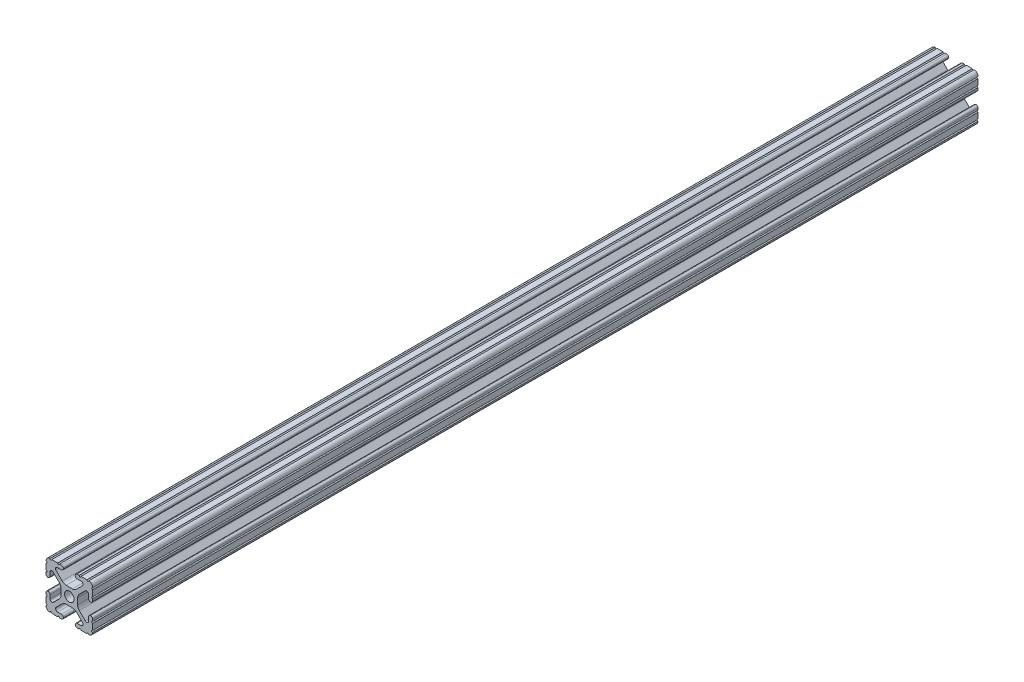
from build123d import *

# Parameters (mm, degrees)
SKETCH1_R           = 2.6035
BOSS_EXTRUDE1_DEPTH = 304.8
SKETCH2_R           = 22.453588809
CUT_EXTRUDE1_DEPTH  = 127


with BuildPart() as part:
    # Sketch1 → Boss-Extrude1 (new, symmetric)
    with BuildSketch(Plane.XY):
        with BuildLine():
            Line((-7.179650497, -8.645192506), (-3.952270251, -5.423690499))
            ThreePointArc((-3.952270251, -5.423690499), (-2.922936451, -4.736929036), (-1.709253557, -4.4958))
            Line((-1.709253557, -4.4958), (1.709253557, -4.4958))
            ThreePointArc((1.709253557, -4.4958), (2.922936451, -4.736929036), (3.952270251, -5.423690499))
            Line((3.952270251, -5.423690499), (7.179650497, -8.645192506))
            ThreePointArc((7.179650497, -8.645192506), (7.41473083, -9.822813117), (6.416408329, -10.4902))
            Line((6.416408329, -10.4902), (4.287512407, -10.4902))
            ThreePointArc((4.287512407, -10.4902), (3.54574862, -10.79744862), (3.2385, -11.539212407))
            Line((3.2385, -11.539212407), (3.2385, -11.650987593))
            ThreePointArc((3.2385, -11.650987593), (3.54574862, -12.39275138), (4.287512407, -12.7))
            Line((4.287512407, -12.7), (5.317126718, -12.7))
            ThreePointArc((5.317126718, -12.7), (5.825126718, -12.192), (6.333126718, -12.7))
            Line((6.333126718, -12.7), (9.550443118, -12.7))
            ThreePointArc((9.550443118, -12.7), (10.058366869, -12.192000006), (10.566443095, -12.699847501))
            ThreePointArc((10.566443095, -12.699847501), (12.082537762, -12.08250727), (12.699846982, -10.566399977))
            ThreePointArc((12.699846982, -10.566399977), (12.192000006, -10.058323491), (12.7, -9.5504))
            Line((12.7, -9.5504), (12.7, -6.3330836))
            ThreePointArc((12.7, -6.3330836), (12.192, -5.8250836), (12.7, -5.3170836))
            Line((12.7, -5.3170836), (12.7, -4.287469289))
            ThreePointArc((12.7, -4.287469289), (12.39275138, -3.545705502), (11.650987593, -3.238456882))
            Line((11.650987593, -3.238456882), (11.539212407, -3.238456882))
            ThreePointArc((11.539212407, -3.238456882), (10.79744862, -3.545705502), (10.4902, -4.287469289))
            Line((10.4902, -4.287469289), (10.4902, -6.402089023))
            ThreePointArc((10.4902, -6.402089023), (9.856505071, -7.351067942), (8.737131347, -7.129408934))
            Line((8.737131347, -7.129408934), (5.441005833, -3.840816462))
            ThreePointArc((5.441005833, -3.840816462), (4.750877967, -2.809883091), (4.5085, -1.593185507))
            Line((4.5085, -1.593185507), (4.5085, 1.593185507))
            ThreePointArc((4.5085, 1.593185507), (4.750877967, 2.809883091), (5.441005833, 3.840816462))
            Line((5.441005833, 3.840816462), (8.737131347, 7.129408934))
            ThreePointArc((8.737131347, 7.129408934), (9.856505071, 7.351067942), (10.4902, 6.402089023))
            Line((10.4902, 6.402089023), (10.4902, 4.287469289))
            ThreePointArc((10.4902, 4.287469289), (10.79744862, 3.545705502), (11.539212407, 3.238456882))
            Line((11.539212407, 3.238456882), (11.650987593, 3.238456882))
            ThreePointArc((11.650987593, 3.238456882), (12.39275138, 3.545705502), (12.7, 4.287469289))
            Line((12.7, 4.287469289), (12.7, 5.3170836))
            ThreePointArc((12.7, 5.3170836), (12.192, 5.8250836), (12.7, 6.3330836))
            Line((12.7, 6.3330836), (12.7, 9.5504))
            ThreePointArc((12.7, 9.5504), (12.192000006, 10.058323491), (12.699846982, 10.566399977))
            ThreePointArc((12.699846982, 10.566399977), (12.082537762, 12.08250727), (10.566443095, 12.699847501))
            ThreePointArc((10.566443095, 12.699847501), (10.058366869, 12.192000006), (9.550443118, 12.7))
            Line((9.550443118, 12.7), (6.333126718, 12.7))
            ThreePointArc((6.333126718, 12.7), (5.825126718, 12.192), (5.317126718, 12.7))
            Line((5.317126718, 12.7), (4.287512407, 12.7))
            ThreePointArc((4.287512407, 12.7), (3.54574862, 12.39275138), (3.2385, 11.650987593))
            Line((3.2385, 11.650987593), (3.2385, 11.539212407))
            ThreePointArc((3.2385, 11.539212407), (3.54574862, 10.79744862), (4.287512407, 10.4902))
            Line((4.287512407, 10.4902), (6.476788598, 10.4902))
            ThreePointArc((6.476788598, 10.4902), (7.432222385, 9.85140422), (7.207036008, 8.724370562))
            Line((7.207036008, 8.724370562), (3.898272566, 5.423169045))
            ThreePointArc((3.898272566, 5.423169045), (2.869120213, 4.736787962), (1.655778399, 4.4958))
            Line((1.655778399, 4.4958), (-1.655778399, 4.4958))
            ThreePointArc((-1.655778399, 4.4958), (-2.869120213, 4.736787962), (-3.898272566, 5.423169045))
            Line((-3.898272566, 5.423169045), (-7.207036008, 8.724370562))
            ThreePointArc((-7.207036008, 8.724370562), (-7.432222385, 9.85140422), (-6.476788598, 10.4902))
            Line((-6.476788598, 10.4902), (-4.287512407, 10.4902))
            ThreePointArc((-4.287512407, 10.4902), (-3.54574862, 10.79744862), (-3.2385, 11.539212407))
            Line((-3.2385, 11.539212407), (-3.2385, 11.650987593))
            ThreePointArc((-3.2385, 11.650987593), (-3.54574862, 12.39275138), (-4.287512407, 12.7))
            Line((-4.287512407, 12.7), (-5.317126718, 12.7))
            ThreePointArc((-5.317126718, 12.7), (-5.825126718, 12.192), (-6.333126718, 12.7))
            Line((-6.333126718, 12.7), (-9.550443118, 12.7))
            ThreePointArc((-9.550443118, 12.7), (-10.058366869, 12.192000006), (-10.566443095, 12.699847501))
            ThreePointArc((-10.566443095, 12.699847501), (-12.082537762, 12.08250727), (-12.699846982, 10.566399977))
            ThreePointArc((-12.699846982, 10.566399977), (-12.192000006, 10.058323491), (-12.7, 9.5504))
            Line((-12.7, 9.5504), (-12.7, 6.3330836))
            ThreePointArc((-12.7, 6.3330836), (-12.192, 5.8250836), (-12.7, 5.3170836))
            Line((-12.7, 5.3170836), (-12.7, 4.287469289))
            ThreePointArc((-12.7, 4.287469289), (-12.39275138, 3.545705502), (-11.650987593, 3.238456882))
            Line((-11.650987593, 3.238456882), (-11.539212407, 3.238456882))
            ThreePointArc((-11.539212407, 3.238456882), (-10.79744862, 3.545705502), (-10.4902, 4.287469289))
            Line((-10.4902, 4.287469289), (-10.4902, 6.402089023))
            ThreePointArc((-10.4902, 6.402089023), (-9.856505071, 7.351067942), (-8.737131347, 7.129408934))
            Line((-8.737131347, 7.129408934), (-5.441005833, 3.840816462))
            ThreePointArc((-5.441005833, 3.840816462), (-4.750877967, 2.809883091), (-4.5085, 1.593185507))
            Line((-4.5085, 1.593185507), (-4.5085, -1.593185507))
            ThreePointArc((-4.5085, -1.593185507), (-4.750877967, -2.809883091), (-5.441005833, -3.840816462))
            Line((-5.441005833, -3.840816462), (-8.737131347, -7.129408934))
            ThreePointArc((-8.737131347, -7.129408934), (-9.856505071, -7.351067942), (-10.4902, -6.402089023))
            Line((-10.4902, -6.402089023), (-10.4902, -4.287469289))
            ThreePointArc((-10.4902, -4.287469289), (-10.79744862, -3.545705502), (-11.539212407, -3.238456882))
            Line((-11.539212407, -3.238456882), (-11.650987593, -3.238456882))
            ThreePointArc((-11.650987593, -3.238456882), (-12.39275138, -3.545705502), (-12.7, -4.287469289))
            Line((-12.7, -4.287469289), (-12.7, -5.3170836))
            ThreePointArc((-12.7, -5.3170836), (-12.192, -5.8250836), (-12.7, -6.3330836))
            Line((-12.7, -6.3330836), (-12.7, -9.5504))
            ThreePointArc((-12.7, -9.5504), (-12.192000006, -10.058323491), (-12.699846982, -10.566399977))
            ThreePointArc((-12.699846982, -10.566399977), (-12.082537762, -12.08250727), (-10.566443095, -12.699847501))
            ThreePointArc((-10.566443095, -12.699847501), (-10.058366869, -12.192000006), (-9.550443118, -12.7))
            Line((-9.550443118, -12.7), (-6.333126718, -12.7))
            ThreePointArc((-6.333126718, -12.7), (-5.825126718, -12.192), (-5.317126718, -12.7))
            Line((-5.317126718, -12.7), (-4.287512407, -12.7))
            ThreePointArc((-4.287512407, -12.7), (-3.54574862, -12.39275138), (-3.2385, -11.650987593))
            Line((-3.2385, -11.650987593), (-3.2385, -11.539212407))
            ThreePointArc((-3.2385, -11.539212407), (-3.54574862, -10.79744862), (-4.287512407, -10.4902))
            Line((-4.287512407, -10.4902), (-6.416408329, -10.4902))
            ThreePointArc((-6.416408329, -10.4902), (-7.41473083, -9.822813117), (-7.179650497, -8.645192506))
        make_face()
        with Locations(Location((0, 0, 0), (0, 0, 180))):
            Circle(SKETCH1_R, mode=Mode.SUBTRACT)
    extrude(amount=BOSS_EXTRUDE1_DEPTH, both=True)

    # Sketch2 → Cut-Extrude1 (cut)
    with BuildSketch(Plane(origin=(0, 0, -304.8), x_dir=(-1, 0, 0), z_dir=(0, 0, -1))):
        Circle(SKETCH2_R)
    extrude(amount=-CUT_EXTRUDE1_DEPTH, mode=Mode.SUBTRACT)


solid = part.part
